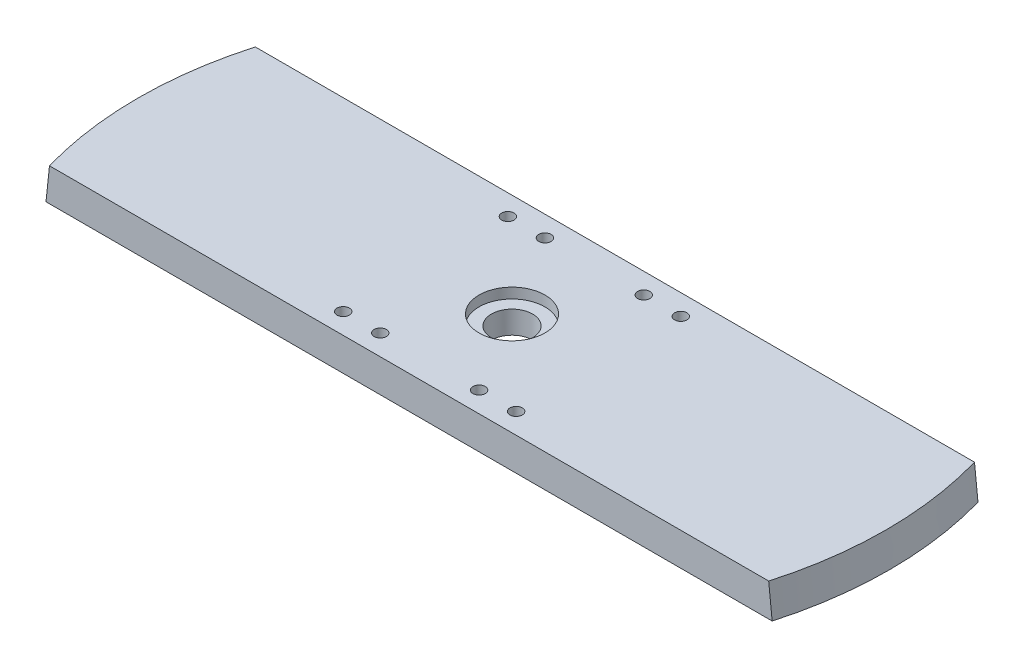
from build123d import *

# Parameters (mm, degrees)
BASE_PLATE_BOSS_EXTRUDE1_DEPTH                 = 25
BASE_PLATE_BOSS_EXTRUDE1_DEPTH_BACK            = 25
SKETCH5_R                                      = 5
SHAFT_CUT_EXTRUDE1_DEPTH                       = 8
SKETCH6_R                                      = 8
SHAFT_BEARING_CUT_EXTRUDE2_DEPTH               = 2.5
SKETCH7_R                                      = 1.5
BEARING_PLATE_MOUNTING_HOLES_CUT_EXTRUDE_DEPTH = 8
SKETCH8_R                                      = 1.5
BASE_SIDE_MOUNTING_HOLES_CUT_EXTRUDE4_DEPTH    = 8


with BuildPart() as part:
    # Sketch3 → Base Plate Boss-Extrude1 (new, two sides: drawn at the far end of the back side and taken through both)
    with BuildSketch(Plane.XY.offset(-BASE_PLATE_BOSS_EXTRUDE1_DEPTH_BACK)):
        Polygon((90.858272566, 8), (91.670882932, 0), (-91.670882932, 0), (-90.858272566, 8), align=None)
    extrude(amount=BASE_PLATE_BOSS_EXTRUDE1_DEPTH + BASE_PLATE_BOSS_EXTRUDE1_DEPTH_BACK)

    # Sketch4 → Base Plate Chassi Rounding Cut-Revolve1 (revolve, cut)
    with BuildSketch(Plane.XY):
        Polygon((90.858272566, 8), (91.670882932, 0), (97.920865853, 0), (97.920865853, 8), (91.670882932, 8), align=None)
    revolve(axis=Axis((0, 0, 0), (0, 1, 0)), mode=Mode.SUBTRACT)

    # Sketch5 → Shaft Cut-Extrude1 (cut)
    with BuildSketch(Plane.XZ):
        Circle(SKETCH5_R)
    extrude(amount=-SHAFT_CUT_EXTRUDE1_DEPTH, mode=Mode.SUBTRACT)

    # Sketch6 → Shaft Bearing Cut-Extrude2 (cut)
    with BuildSketch(Plane(origin=(0, 8, 0), x_dir=(1, 0, 0), z_dir=(0, 1, 0))):
        with Locations(Location((0, 0, 0), (0, 0, 180))):
            Circle(SKETCH6_R)
    extrude(amount=-SHAFT_BEARING_CUT_EXTRUDE2_DEPTH, mode=Mode.SUBTRACT)

    # Sketch7 → Bearing Plate Mounting Holes Cut-Extrude3 (cut)
    with BuildSketch(Plane(origin=(0, 8, 0), x_dir=(1, 0, 0), z_dir=(0, 1, 0))):
        with Locations(Location((12, 20, 0), (0, 0, 180))):
            Circle(SKETCH7_R)
        with Locations(Location((-12, 20, 0), (0, 0, 180))):
            Circle(SKETCH7_R)
        with Locations(Location((-12, -20, 0), (0, 0, 180))):
            Circle(SKETCH7_R)
        with Locations(Location((12, -20, 0), (0, 0, 180))):
            Circle(SKETCH7_R)
    extrude(amount=-BEARING_PLATE_MOUNTING_HOLES_CUT_EXTRUDE_DEPTH, mode=Mode.SUBTRACT)

    # Sketch8 → Base Side Mounting Holes Cut-Extrude4 (cut)
    with BuildSketch(Plane(origin=(0, 8, 0), x_dir=(1, 0, 0), z_dir=(0, 1, 0))):
        with Locations(Location((21, 20, 0), (0, 0, 180))):
            Circle(SKETCH8_R)
        with Locations(Location((-21, 20, 0), (0, 0, 180))):
            Circle(SKETCH8_R)
        with Locations(Location((-21, -20, 0), (0, 0, 180))):
            Circle(SKETCH8_R)
        with Locations(Location((21, -20, 0), (0, 0, 180))):
            Circle(SKETCH8_R)
    extrude(amount=-BASE_SIDE_MOUNTING_HOLES_CUT_EXTRUDE4_DEPTH, mode=Mode.SUBTRACT)


solid = part.part
